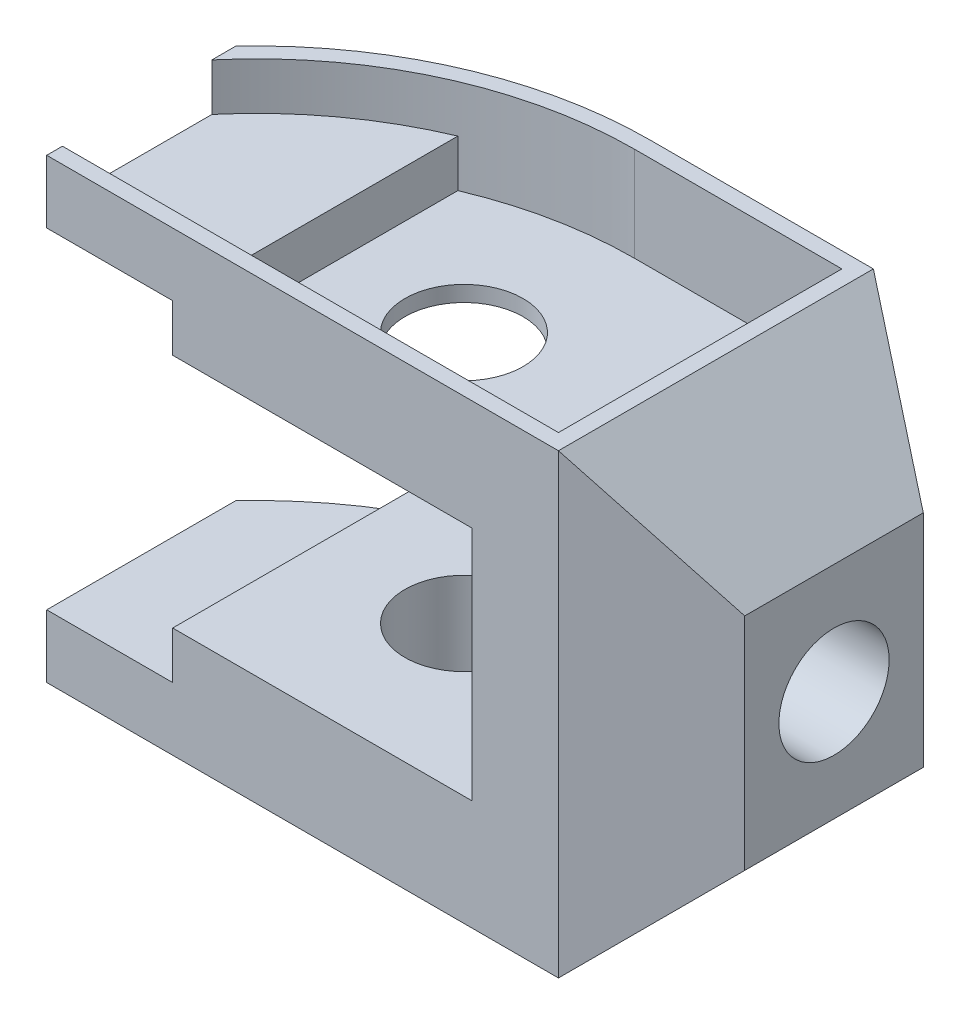
from build123d import *

# Parameters (mm, degrees)
SKETCH1_R           = 7.5
BOSS_EXTRUDE1_DEPTH = 58
CUT_EXTRUDE1_DEPTH  = 107.60206377
CUT_EXTRUDE2_DEPTH  = 107.60206377
SKETCH5_R           = 7
CUT_EXTRUDE3_DEPTH  = 107.60206377
CUT_EXTRUDE4_DEPTH  = 6
CUT_EXTRUDE5_DEPTH  = 6


with BuildPart() as part:
    # Sketch1 → Boss-Extrude1 (new body)
    with BuildSketch(Plane(origin=(0, 0, 0), x_dir=(1, 0, 0), z_dir=(0, 1, 0))):
        with BuildLine():
            Line((0, 0), (65, 0))
            Line((65, 0), (80, 8.660254038))
            Line((80, 8.660254038), (80, 31.339745962))
            Line((80, 31.339745962), (65, 40))
            Line((65, 40), (36.66060556, 40))
            ThreePointArc((36.66060556, 40), (16.66060556, 35.82575695), (0, 24))
            Line((0, 24), (0, 0))
        make_face()
        with Locations(Location((34, 19, 0), (0, 0, 90))):
            Circle(SKETCH1_R, mode=Mode.SUBTRACT)
    extrude(amount=BOSS_EXTRUDE1_DEPTH)

    # Sketch2 → Cut-Extrude1 (cut, through all)
    with BuildSketch(Plane.XY):
        Polygon((0, 50), (16, 50), (16, 44), (54, 44), (54, 14), (16, 14), (16, 8), (0, 8), align=None)
    extrude(amount=-CUT_EXTRUDE1_DEPTH, mode=Mode.SUBTRACT)

    # Sketch4 → Cut-Extrude2 (cut, through all)
    with BuildSketch(Plane.XY):
        Polygon((65, 58), (80, 43), (80, 58), align=None)
        Polygon((65, 0), (80, 0), (80, 15), align=None)
    extrude(amount=-CUT_EXTRUDE2_DEPTH, mode=Mode.SUBTRACT)

    # Sketch5 → Cut-Extrude3 (cut, through all)
    with BuildSketch(Plane(origin=(80, 0, 0), x_dir=(0, 0, -1), z_dir=(1, 0, 0))):
        with Locations((20, 29)):
            Circle(SKETCH5_R)
    extrude(amount=-CUT_EXTRUDE3_DEPTH, mode=Mode.SUBTRACT)

    # Sketch8 → Cut-Extrude4 (cut)
    with BuildSketch(Plane(origin=(0, 58, 0), x_dir=(1, 0, 0), z_dir=(0, 1, 0))):
        with BuildLine():
            Line((0, 2), (0, 20.98386677))
            ThreePointArc((0, 20.98386677), (16.452013389, 33.538635744), (36.66060556, 38))
            Line((36.66060556, 38), (63, 38))
            Line((63, 38), (63, 2))
            Line((63, 2), (0, 2))
        make_face()
    extrude(amount=-CUT_EXTRUDE4_DEPTH, mode=Mode.SUBTRACT)

    # Sketch9 → Cut-Extrude5 (cut)
    with BuildSketch(Plane(origin=(0, 52, 0), x_dir=(1, 0, 0), z_dir=(0, 1, 0))):
        with BuildLine():
            Line((18, 2), (63, 2))
            Line((63, 2), (63, 38))
            Line((63, 38), (36.66060556, 38))
            ThreePointArc((36.66060556, 38), (27.141221384, 37.046586751), (18, 34.224221872))
            Line((18, 34.224221872), (18, 2))
        make_face()
    extrude(amount=-CUT_EXTRUDE5_DEPTH, mode=Mode.SUBTRACT)


solid = part.part
